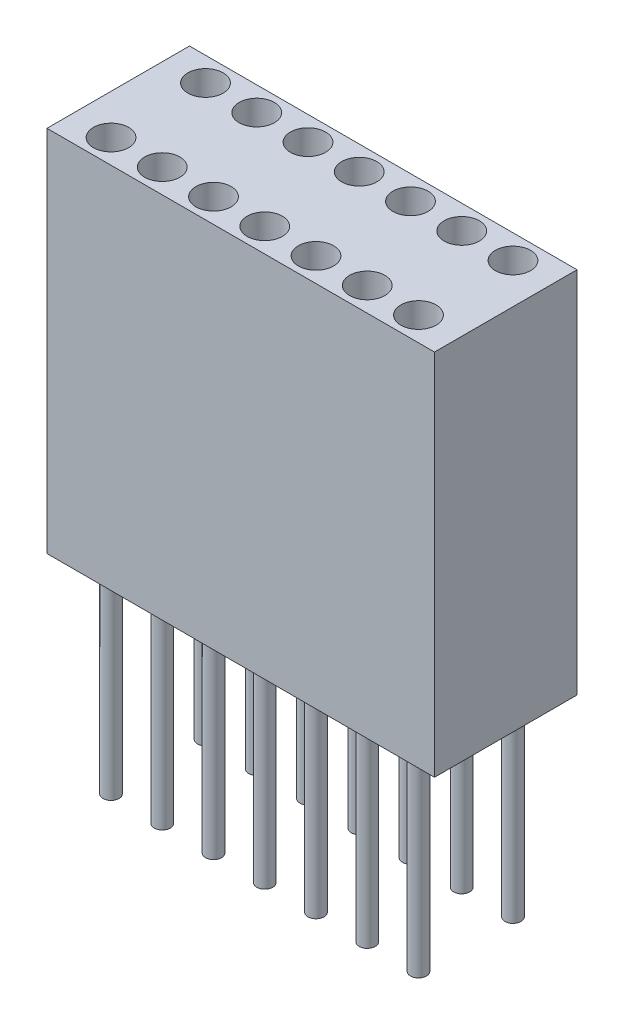
from build123d import *

# Parameters (mm, degrees)
SKETCH2_W           = 4.84
SKETCH2_H           = 1.78
BOSS_EXTRUDE1_DEPTH = 4.6
SKETCH3_R           = 0.22
CUT_EXTRUDE1_DEPTH  = 4.5
SKETCH5_R           = 0.1
BOSS_EXTRUDE2_DEPTH = 2.5


with BuildPart() as part:
    # Sketch2 → Boss-Extrude1 (new body)
    with BuildSketch(Plane(origin=(0, 0, 0), x_dir=(1, 0, 0), z_dir=(0, 1, 0))):
        with Locations((2.42, 0.89)):
            Rectangle(SKETCH2_W, SKETCH2_H)
    extrude(amount=BOSS_EXTRUDE1_DEPTH)

    # Sketch3 → Cut-Extrude1 (cut)
    with BuildSketch(Plane(origin=(0, 4.6, 0), x_dir=(1, 0, 0), z_dir=(0, 1, 0))):
        with Locations(Location((0.5, 1.48, 0), (0, 0, 270))):
            Circle(SKETCH3_R)
        with Locations(Location((1.14, 1.48, 0), (0, 0, 270))):
            Circle(SKETCH3_R)
        with Locations(Location((1.78, 1.48, 0), (0, 0, 270))):
            Circle(SKETCH3_R)
        with Locations(Location((2.42, 1.48, 0), (0, 0, 270))):
            Circle(SKETCH3_R)
        with Locations(Location((3.06, 1.48, 0), (0, 0, 270))):
            Circle(SKETCH3_R)
        with Locations(Location((3.7, 1.48, 0), (0, 0, 270))):
            Circle(SKETCH3_R)
        with Locations(Location((4.34, 1.48, 0), (0, 0, 270))):
            Circle(SKETCH3_R)
        with Locations(Location((0.5, 0.3, 0), (0, 0, 270))):
            Circle(SKETCH3_R)
        with Locations(Location((1.14, 0.3, 0), (0, 0, 270))):
            Circle(SKETCH3_R)
        with Locations(Location((1.78, 0.3, 0), (0, 0, 270))):
            Circle(SKETCH3_R)
        with Locations(Location((2.42, 0.3, 0), (0, 0, 270))):
            Circle(SKETCH3_R)
        with Locations(Location((3.06, 0.3, 0), (0, 0, 270))):
            Circle(SKETCH3_R)
        with Locations(Location((3.7, 0.3, 0), (0, 0, 270))):
            Circle(SKETCH3_R)
        with Locations(Location((4.34, 0.3, 0), (0, 0, 270))):
            Circle(SKETCH3_R)
    extrude(amount=-CUT_EXTRUDE1_DEPTH, mode=Mode.SUBTRACT)

    # Sketch5 → Boss-Extrude2 (add)
    with BuildSketch(Plane.XZ):
        with Locations(Location((0.5, -0.3, 0), (0, 0, 270))):
            Circle(SKETCH5_R)
        with Locations(Location((1.14, -0.3, 0), (0, 0, 270))):
            Circle(SKETCH5_R)
        with Locations(Location((1.78, -0.3, 0), (0, 0, 270))):
            Circle(SKETCH5_R)
        with Locations(Location((2.42, -0.3, 0), (0, 0, 270))):
            Circle(SKETCH5_R)
        with Locations(Location((3.06, -0.3, 0), (0, 0, 270))):
            Circle(SKETCH5_R)
        with Locations(Location((3.7, -0.3, 0), (0, 0, 270))):
            Circle(SKETCH5_R)
        with Locations(Location((4.34, -0.3, 0), (0, 0, 270))):
            Circle(SKETCH5_R)
        with Locations(Location((0.5, -1.48, 0), (0, 0, 270))):
            Circle(SKETCH5_R)
        with Locations(Location((1.14, -1.48, 0), (0, 0, 270))):
            Circle(SKETCH5_R)
        with Locations(Location((1.78, -1.48, 0), (0, 0, 270))):
            Circle(SKETCH5_R)
        with Locations(Location((2.42, -1.48, 0), (0, 0, 270))):
            Circle(SKETCH5_R)
        with Locations(Location((3.06, -1.48, 0), (0, 0, 270))):
            Circle(SKETCH5_R)
        with Locations(Location((3.7, -1.48, 0), (0, 0, 270))):
            Circle(SKETCH5_R)
        with Locations(Location((4.34, -1.48, 0), (0, 0, 270))):
            Circle(SKETCH5_R)
    extrude(amount=BOSS_EXTRUDE2_DEPTH)


solid = part.part
